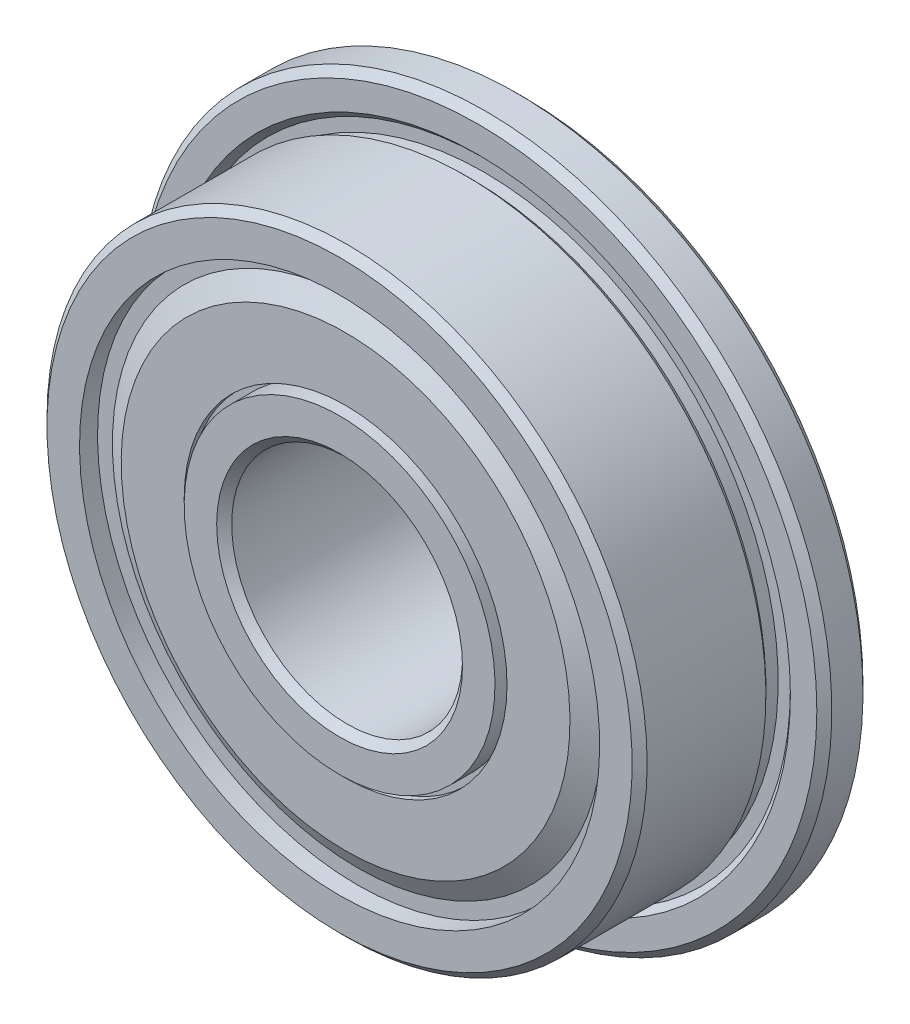
from build123d import *

# Parameters (mm, degrees)
FILLET1_SIZE      = 0.1625
FILLET2_SIZE      = 0.1625
CIRPATTERN3_COUNT = 10
SKETCH8_W         = 0.52
SKETCH8_H         = 0.433333333


with BuildPart() as part:
    # Sketch2 → Revolve1 (revolve)
    with BuildSketch(Plane(origin=(0, 0, 0), x_dir=(0, 0, -1), z_dir=(1, 0, 0)), mode=Mode.PRIVATE) as revolve1_sk:
        with BuildLine():
            Line((2, 7.5), (1, 7.5))
            Line((1, 7.5), (1, 6.765165043))
            Line((1, 6.765165043), (1.132582521, 6.632582521))
            Line((1.132582521, 6.632582521), (1.132582521, 6.367417479))
            Line((1.132582521, 6.367417479), (0.867417479, 6.367417479))
            Line((0.867417479, 6.367417479), (0.734834957, 6.5))
            Line((0.734834957, 6.5), (-2, 6.5))
            Line((-2, 6.5), (-2, 5.2))
            Line((-2, 5.2), (-0.714142843, 5.2))
            ThreePointArc((-0.714142843, 5.2), (0, 5.5), (0.714142843, 5.2))
            Line((0.714142843, 5.2), (2, 5.2))
            Line((2, 5.2), (2, 7.5))
        make_face()
        with BuildLine():
            Line((2, 2.5), (-2, 2.5))
            Line((-2, 2.5), (-2, 3.8))
            Line((-2, 3.8), (-0.714142843, 3.8))
            ThreePointArc((-0.714142843, 3.8), (0, 3.5), (0.714142843, 3.8))
            Line((0.714142843, 3.8), (2, 3.8))
            Line((2, 3.8), (2, 2.5))
        make_face()
    revolve(revolve1_sk.sketch.rotate(Axis((0, 0, 0), (0, 0, -1)), 180), axis=Axis((0, 0, 0), (0, 0, -1)))

    # Fillet1
    fillet1_edges = [part.edges().sort_by_distance(p)[0] for p in [
        (0, 6.5, 2),
        (0, 7.5, -2),
        (0, 7.5, -1),
    ]]
    chamfer(fillet1_edges, length=FILLET1_SIZE)

    # Fillet2
    fillet2_edges = [part.edges().sort_by_distance(p)[0] for p in [
        (0, 2.5, -2),
        (0, 2.5, 2),
    ]]
    chamfer(fillet2_edges, length=FILLET2_SIZE)

    # Sketch8 → Cut-Revolve1 (revolve, cut)
    with BuildSketch(Plane(origin=(0, 0, 0), x_dir=(0, 0, -1), z_dir=(1, 0, 0)), mode=Mode.PRIVATE) as cut_revolve1_sk:
        with Locations((-1.74, 5.416666667)):
            Rectangle(SKETCH8_W, SKETCH8_H)
        with Locations((1.74, 5.416666667)):
            Rectangle(SKETCH8_W, SKETCH8_H)
        with Locations((1.74, 3.583333334)):
            Rectangle(SKETCH8_W, SKETCH8_H)
        with Locations((-1.74, 3.583333334)):
            Rectangle(SKETCH8_W, SKETCH8_H)
    revolve(cut_revolve1_sk.sketch.rotate(Axis((0, 0, 0), (0, 0, -1)), 180), axis=Axis((0, 0, 0), (0, 0, -1)), mode=Mode.SUBTRACT)


with BuildPart() as body_2:
    # Sketch7 → Revolve3 (revolve)
    with BuildSketch(Plane.XY):
        with BuildLine():
            Line((0, 5.5), (0, 3.5))
            ThreePointArc((0, 3.5), (-1, 4.5), (0, 5.5))
        make_face()
    revolve(axis=Axis((0, 5.5, 0), (0, -1, 0)))


with BuildPart() as cirpattern3_1:
    # CirPattern3: pattern copy
    add(body_2.part.rotate(Axis((0, 0, 0), (0, 0, 1)), 1 * 360 / CIRPATTERN3_COUNT))


with BuildPart() as cirpattern3_2:
    # CirPattern3: pattern copy
    add(body_2.part.rotate(Axis((0, 0, 0), (0, 0, 1)), 2 * 360 / CIRPATTERN3_COUNT))


with BuildPart() as cirpattern3_3:
    # CirPattern3: pattern copy
    add(body_2.part.rotate(Axis((0, 0, 0), (0, 0, 1)), 3 * 360 / CIRPATTERN3_COUNT))


with BuildPart() as cirpattern3_4:
    # CirPattern3: pattern copy
    add(body_2.part.rotate(Axis((0, 0, 0), (0, 0, 1)), 4 * 360 / CIRPATTERN3_COUNT))


with BuildPart() as cirpattern3_5:
    # CirPattern3: pattern copy
    add(body_2.part.rotate(Axis((0, 0, 0), (0, 0, 1)), 5 * 360 / CIRPATTERN3_COUNT))


with BuildPart() as cirpattern3_6:
    # CirPattern3: pattern copy
    add(body_2.part.rotate(Axis((0, 0, 0), (0, 0, 1)), 6 * 360 / CIRPATTERN3_COUNT))


with BuildPart() as cirpattern3_7:
    # CirPattern3: pattern copy
    add(body_2.part.rotate(Axis((0, 0, 0), (0, 0, 1)), 7 * 360 / CIRPATTERN3_COUNT))


with BuildPart() as cirpattern3_8:
    # CirPattern3: pattern copy
    add(body_2.part.rotate(Axis((0, 0, 0), (0, 0, 1)), 8 * 360 / CIRPATTERN3_COUNT))


with BuildPart() as cirpattern3_9:
    # CirPattern3: pattern copy
    add(body_2.part.rotate(Axis((0, 0, 0), (0, 0, 1)), 9 * 360 / CIRPATTERN3_COUNT))


with BuildPart() as body_12:
    # Sketch9 → Revolve4 (revolve)
    with BuildSketch(Plane(origin=(0, 0, 0), x_dir=(0, 0, -1), z_dir=(1, 0, 0)), mode=Mode.PRIVATE) as revolve4_sk:
        Polygon((-1.48, 5.633333333), (-1.48, 5.276190476), (-1.74, 4.825857266), (-1.74, 3.496666667), (-1.87, 3.496666667), (-1.87, 4.860690661), (-1.61, 5.311023871), (-1.61, 5.633333333), align=None)
        Polygon((1.48, 5.633333333), (1.48, 5.276190476), (1.74, 4.825857266), (1.74, 3.496666667), (1.87, 3.496666667), (1.87, 4.860690661), (1.61, 5.311023871), (1.61, 5.633333333), align=None)
    revolve(revolve4_sk.sketch.rotate(Axis((0, 0, 0), (0, 0, -1)), 180), axis=Axis((0, 0, 0), (0, 0, -1)))


solid = Compound([part.part, body_2.part, cirpattern3_1.part, cirpattern3_2.part, cirpattern3_3.part, cirpattern3_4.part, cirpattern3_5.part, cirpattern3_6.part, cirpattern3_7.part, cirpattern3_8.part, cirpattern3_9.part, body_12.part])
